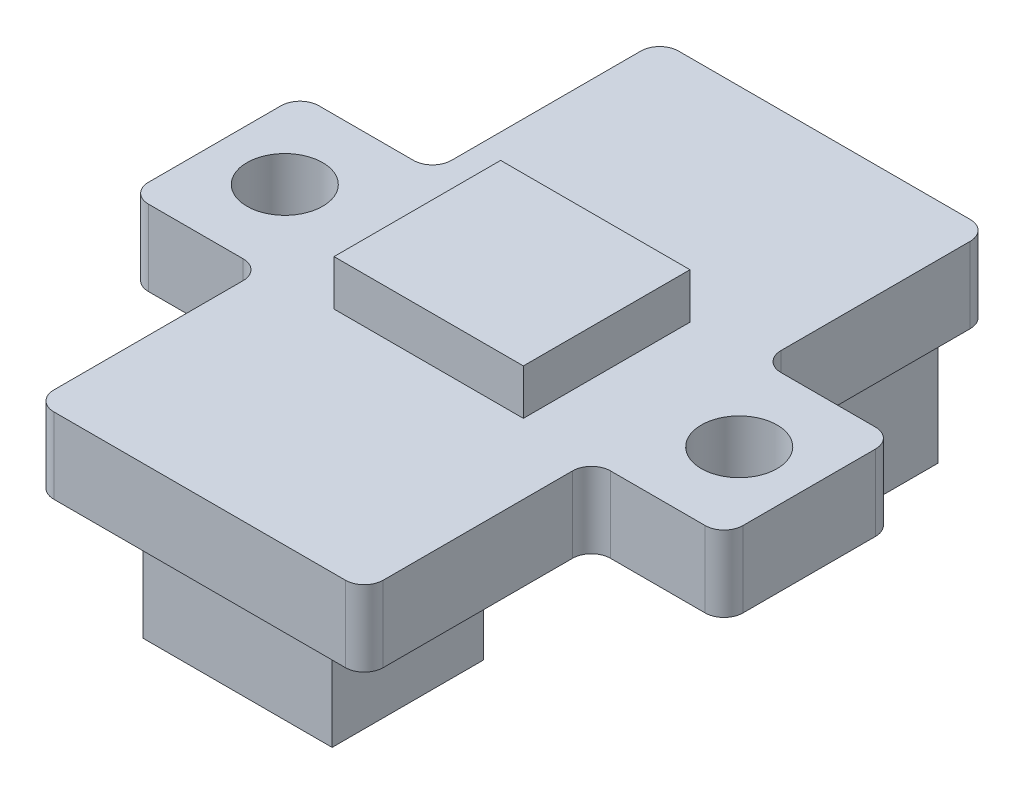
from build123d import *

# Parameters (mm, degrees)
SKETCH1_W           = 8.7
SKETCH1_H           = 6
SKETCH1_H_2         = 4.5
SKETCH1_W_2         = 3.5
SKETCH1_R           = 1
BOSS_EXTRUDE1_DEPTH = 2
FILLET1_R           = 0.5
SKETCH2_W           = 8
SKETCH2_H           = 4.5
SKETCH2_W_2         = 5
SKETCH2_H_2         = 4
BOSS_EXTRUDE2_DEPTH = 3
SKETCH3_W           = 5
SKETCH3_H           = 4.4
BOSS_EXTRUDE3_DEPTH = 1.2


with BuildPart() as part:
    # Sketch1 → Boss-Extrude1 (new body)
    # profile 1 of 5: a face of its own
    with BuildSketch(Plane(origin=(0, 0, 0), x_dir=(1, 0, 0), z_dir=(0, 1, 0))):
        with Locations((0, 5.25)):
            Rectangle(SKETCH1_W, SKETCH1_H)
    # profile 2 of 5: a face of its own
    with BuildSketch(Plane(origin=(0, 0, 0), x_dir=(1, 0, 0), z_dir=(0, 1, 0))):
        Rectangle(SKETCH1_W, SKETCH1_H_2)
    # profile 3 of 5: a face of its own
    with BuildSketch(Plane(origin=(0, 0, 0), x_dir=(1, 0, 0), z_dir=(0, 1, 0))):
        with Locations((-6.1, 0)):
            Rectangle(SKETCH1_W_2, SKETCH1_H_2)
        with Locations(Location((-6, 0, 0), (0, 0, 270))):
            Circle(SKETCH1_R, mode=Mode.SUBTRACT)
    # profile 4 of 5: a face of its own
    with BuildSketch(Plane(origin=(0, 0, 0), x_dir=(1, 0, 0), z_dir=(0, 1, 0))):
        with Locations((6.1, 0)):
            Rectangle(SKETCH1_W_2, SKETCH1_H_2)
        with Locations(Location((6, 0, 0), (0, 0, 270))):
            Circle(SKETCH1_R, mode=Mode.SUBTRACT)
    # profile 5 of 5: a face of its own
    with BuildSketch(Plane(origin=(0, 0, 0), x_dir=(1, 0, 0), z_dir=(0, 1, 0))):
        with Locations((0, -5.25)):
            Rectangle(SKETCH1_W, SKETCH1_H)
    extrude(amount=BOSS_EXTRUDE1_DEPTH)

    # Fillet1
    fillet1_edges = [part.edges().sort_by_distance(p)[0] for p in [
        (-4.35, 1, -8.25),
        (4.35, 1, -8.25),
        (4.35, 1, -2.25),
        (7.85, 1, -2.25),
        (7.85, 1, 2.25),
        (4.35, 1, 2.25),
        (4.35, 1, 8.25),
        (-4.35, 1, 8.25),
        (-4.35, 1, 2.25),
        (-7.85, 1, 2.25),
        (-7.85, 1, -2.25),
        (-4.35, 1, -2.25),
    ]]
    fillet(fillet1_edges, radius=FILLET1_R)

    # Sketch2 → Boss-Extrude2 (add)
    with BuildSketch(Plane.XZ):
        with Locations((0, -5)):
            Rectangle(SKETCH2_W, SKETCH2_H)
        with Locations((0, 5.25)):
            Rectangle(SKETCH2_W_2, SKETCH2_H_2)
    extrude(amount=BOSS_EXTRUDE2_DEPTH)

    # Sketch3 → Boss-Extrude3 (add)
    with BuildSketch(Plane(origin=(0, 2, 0), x_dir=(1, 0, 0), z_dir=(0, 1, 0))):
        Rectangle(SKETCH3_W, SKETCH3_H)
    extrude(amount=BOSS_EXTRUDE3_DEPTH)


solid = part.part
